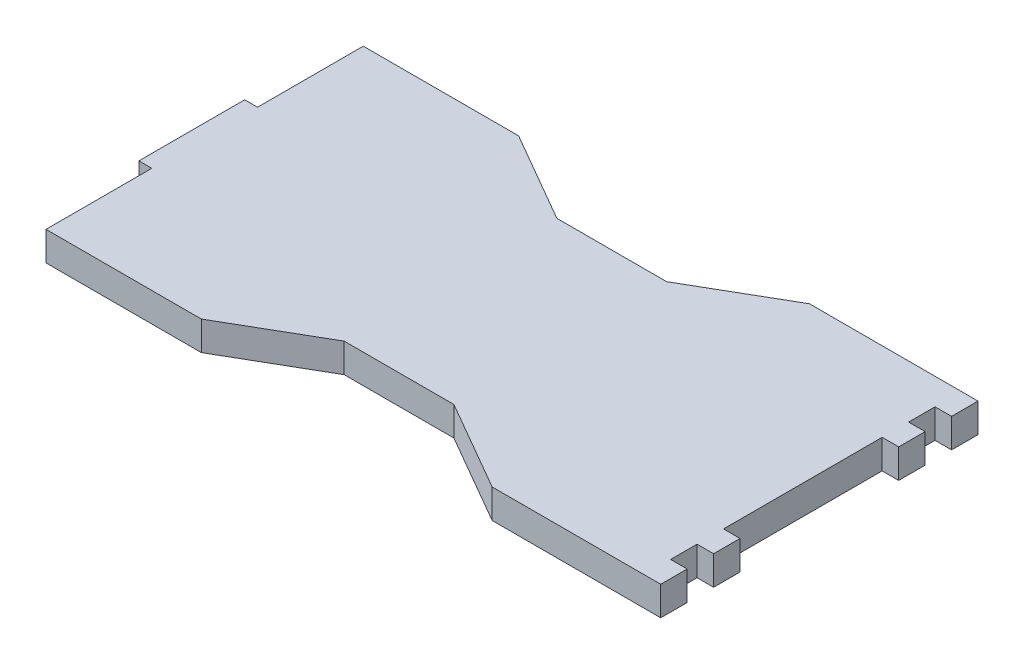
from build123d import *

# Parameters (mm, degrees)
BOSS_EXTRUDE1_DEPTH = 2.2


with BuildPart() as part:
    # Sketch1 → Boss-Extrude1 (new body)
    with BuildSketch(Plane(origin=(0, 0, 0), x_dir=(1, 0, 0), z_dir=(0, 1, 0))):
        Polygon((-43, 9.329521193), (-43, 11.329521193), (-55.75, 11.329521193), (-62.600141904, 7.374589921), (-70.899858096, 7.374589921), (-77.75, 11.329521193), (-89.5, 11.329521193), (-89.5, 3.329521193), (-90.473781123, 3.329521193), (-90.473781123, -4.670478807), (-89.5, -4.670478807), (-89.5, -12.670478807), (-77.75, -12.670478807), (-70.899858096, -8.715547535), (-62.600141904, -8.715547535), (-55.75, -12.670478807), (-43, -12.670478807), (-43, -10.670478807), (-44.25, -10.670478807), (-44.25, -8.670478807), (-43, -8.670478807), (-43, -6.670478807), (-44.25, -6.670478807), (-44.25, 5.329521193), (-43, 5.329521193), (-43, 7.329521193), (-44.25, 7.329521193), (-44.25, 9.329521193), align=None)
    extrude(amount=BOSS_EXTRUDE1_DEPTH)


solid = part.part
